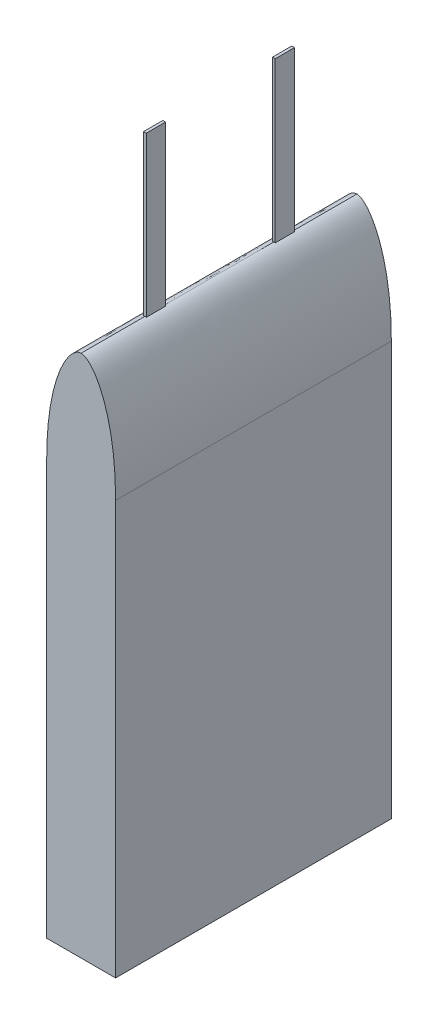
from build123d import *

# Parameters (mm, degrees)
SKETCH1_W                = 20
SKETCH1_H                = 30
BOSS_EXTRUDE1_DEPTH      = 5
BOSS_EXTRUDE2_DEPTH      = 10
BOSS_EXTRUDE2_DEPTH_BACK = 10
BOSS_EXTRUDE3_DEPTH      = 0.1
BOSS_EXTRUDE3_DEPTH_BACK = 0.1
SKETCH4_W                = 1.400067445
SKETCH4_H                = 17.511954704


with BuildPart() as part:
    # Sketch1 → Boss-Extrude1 (new body)
    with BuildSketch(Plane(origin=(0, 0, 0), x_dir=(0, 0, -1), z_dir=(1, 0, 0))):
        Rectangle(SKETCH1_W, SKETCH1_H)
    extrude(amount=BOSS_EXTRUDE1_DEPTH)

    # Sketch3 → Boss-Extrude2 (add, two sides: drawn at the far end of the back side and taken through both)
    with BuildSketch(Plane.XY.offset(-BOSS_EXTRUDE2_DEPTH_BACK)):
        with BuildLine():
            Line((0, 15), (5, 15))
            add(Edge.make_bspline(
                [(2.5, 22.997947181), (3.336578347, 22.9995894), (5.005761453, 20.548525939), (5, 15)],
                knots=[0, 0, 0, 0, 1, 1, 1, 1], degree=3))
            add(Edge.make_bspline(
                [(2.5, 22.997947181), (1.663421653, 22.9995894), (-0.005761453, 20.548525939), (0, 15)],
                knots=[0, 0, 0, 0, 1, 1, 1, 1], degree=3))
        make_face()
    extrude(amount=BOSS_EXTRUDE2_DEPTH + BOSS_EXTRUDE2_DEPTH_BACK)

    # Sketch4 → Boss-Extrude3 (add, two sides: drawn at the far end of the back side and taken through both)
    with BuildSketch(Plane(origin=(2.5, 0, 0), x_dir=(0, 0, -1), z_dir=(1, 0, 0)).offset(-BOSS_EXTRUDE3_DEPTH_BACK)):
        with Locations((4.675225217, 25.800434354)):
            Rectangle(SKETCH4_W, SKETCH4_H)
        with Locations((-4.675225217, 25.800434354)):
            Rectangle(SKETCH4_W, SKETCH4_H)
    extrude(amount=BOSS_EXTRUDE3_DEPTH + BOSS_EXTRUDE3_DEPTH_BACK)


solid = part.part
